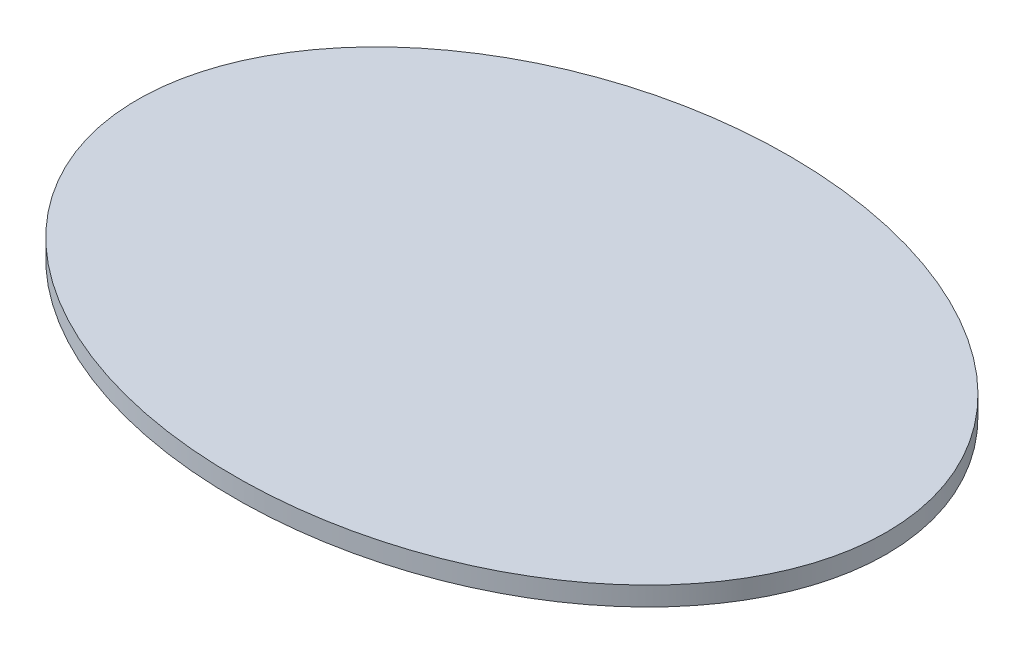
from build123d import *

# Parameters (mm, degrees)
SKETCH1_RX          = 1000.633
SKETCH1_RY          = 740.9434
BOSS_EXTRUDE1_DEPTH = 50.8


with BuildPart() as part:
    # Sketch1 → Boss-Extrude1 (new body)
    with BuildSketch(Plane(origin=(0, 0, 0), x_dir=(1, 0, 0), z_dir=(0, 1, 0))):
        with Locations(Location((0, 0), (0, 0, 0))):
            Ellipse(SKETCH1_RX, SKETCH1_RY)
    extrude(amount=BOSS_EXTRUDE1_DEPTH)


solid = part.part
